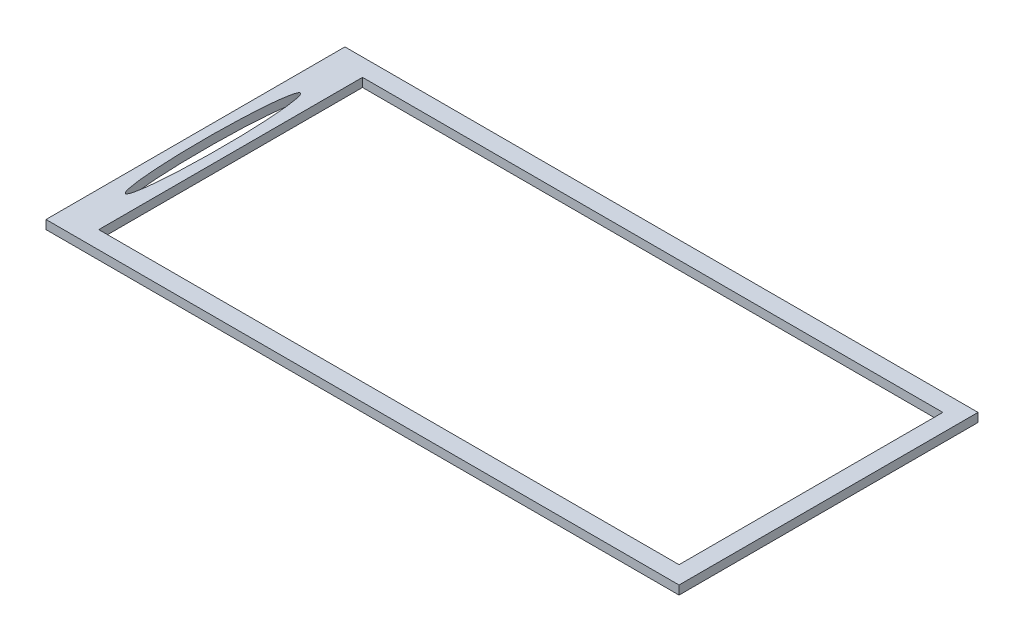
from build123d import *

# Parameters (mm, degrees)
CROQUIS1_W              = 720
CROQUIS1_H              = 340
SALIENTE_EXTRUIR1_DEPTH = 10
CROQUIS3_RX             = 99.333174073
CROQUIS3_RY             = 8.979269973
CROQUIS3_W              = 660
CROQUIS3_H              = 300
CORTAR_EXTRUIR2_DEPTH   = 10


with BuildPart() as part:
    # Croquis1 → Saliente-Extruir1 (new body)
    with BuildSketch(Plane(origin=(0, 0, 0), x_dir=(1, 0, 0), z_dir=(0, 1, 0))):
        Rectangle(CROQUIS1_W, CROQUIS1_H)
    extrude(amount=SALIENTE_EXTRUIR1_DEPTH)

    # Croquis3 → Cortar-Extruir2 (cut)
    with BuildSketch(Plane(origin=(0, 10, 0), x_dir=(1, 0, 0), z_dir=(0, 1, 0))):
        with Locations(Location((-340.089850217, 0), (0, 0, 90))):
            Ellipse(CROQUIS3_RX, CROQUIS3_RY)
        with Locations((10, 0)):
            Rectangle(CROQUIS3_W, CROQUIS3_H)
    extrude(amount=-CORTAR_EXTRUIR2_DEPTH, mode=Mode.SUBTRACT)


solid = part.part
